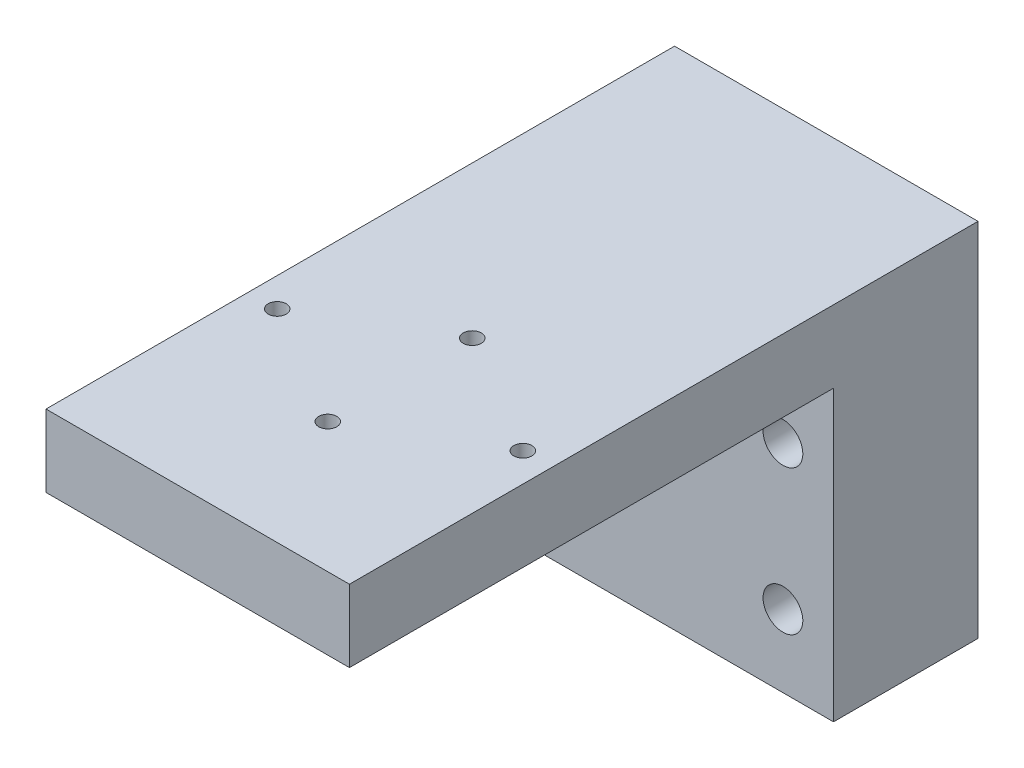
from build123d import *

# Parameters (mm, degrees)
SKETCH_1_W             = 42
SKETCH_1_H             = 50
EXTRUDE_1_DEPTH        = 87
SKETCH_2_W             = 67
SKETCH_2_H             = 40
CUT_EXTRUDE_1_DEPTH    = 109.779593675
SKETCH_3_R             = 2.75
CUT_EXTRUDE_2_DEPTH    = 94.55746897
HOLE_WIZARD_M3_1_D     = 2.5
HOLE_WIZARD_M3_1_DEPTH = 7.5
HOLE_WIZARD_M3_1_TIP   = 0.751075774


with BuildPart() as part:
    # 草图1 → 凸台-拉伸1 (new body)
    with BuildSketch(Plane.XY):
        with Locations((21, 25)):
            Rectangle(SKETCH_1_W, SKETCH_1_H)
    extrude(amount=EXTRUDE_1_DEPTH)

    # 草图2 → 切除-拉伸1 (cut, through all)
    with BuildSketch(Plane(origin=(42, 0, 0), x_dir=(0, 0, -1), z_dir=(1, 0, 0))):
        with Locations((-53.5, 20)):
            Rectangle(SKETCH_2_W, SKETCH_2_H)
    extrude(amount=-CUT_EXTRUDE_1_DEPTH, mode=Mode.SUBTRACT)

    # 草图3 → 切除-拉伸2 (cut, through all)
    with BuildSketch(Plane.XY.offset(20)):
        with Locations((7, 30)):
            Circle(SKETCH_3_R)
        with Locations((7, 10)):
            Circle(SKETCH_3_R)
        with Locations(Location((35, 10, 0), (0, 0, 180))):
            Circle(SKETCH_3_R)
        with Locations(Location((35, 30, 0), (0, 0, 180))):
            Circle(SKETCH_3_R)
    extrude(amount=-CUT_EXTRUDE_2_DEPTH, mode=Mode.SUBTRACT)

    # M3 螺纹孔1
    with Locations(Plane(origin=(0, 50, 0), x_dir=(-1, 0, 0), z_dir=(0, 1, 0))):
        with Locations((-4, 59), (-21, 49), (-38, 59), (-21, 69)):
            Hole(HOLE_WIZARD_M3_1_D / 2, depth=HOLE_WIZARD_M3_1_DEPTH)
            with Locations((0, 0, -(HOLE_WIZARD_M3_1_DEPTH + HOLE_WIZARD_M3_1_TIP / 2))):  # 118° drill point
                Cone(0, HOLE_WIZARD_M3_1_D / 2, HOLE_WIZARD_M3_1_TIP, mode=Mode.SUBTRACT)


solid = part.part
